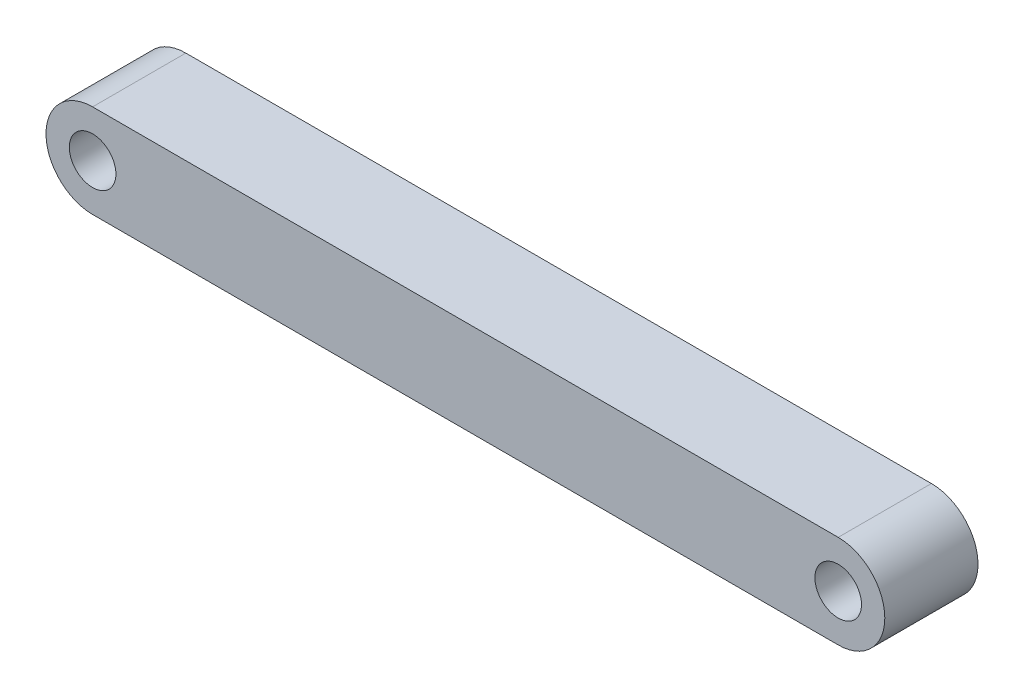
from build123d import *

# Parameters (mm, degrees)
EXTRUDE_1_DEPTH     = 10
SKETCH_2_R          = 2.5
CUT_EXTRUDE_1_DEPTH = 47.368092477


with BuildPart() as part:
    # 草图1 → 凸台-拉伸1 (new body)
    with BuildSketch(Plane.XY):
        with BuildLine():
            Line((-40, 5), (40, 5))
            ThreePointArc((40, 5), (45, 0), (40, -5))
            Line((40, -5), (-40, -5))
            ThreePointArc((-40, -5), (-45, 0), (-40, 5))
        make_face()
    extrude(amount=EXTRUDE_1_DEPTH)

    # 草图2 → 切除-拉伸1 (cut, through all)
    with BuildSketch(Plane.XY.offset(10)):
        with Locations((-40, 0)):
            Circle(SKETCH_2_R)
        with Locations((40, 0)):
            Circle(SKETCH_2_R)
    extrude(amount=-CUT_EXTRUDE_1_DEPTH, mode=Mode.SUBTRACT)


solid = part.part
